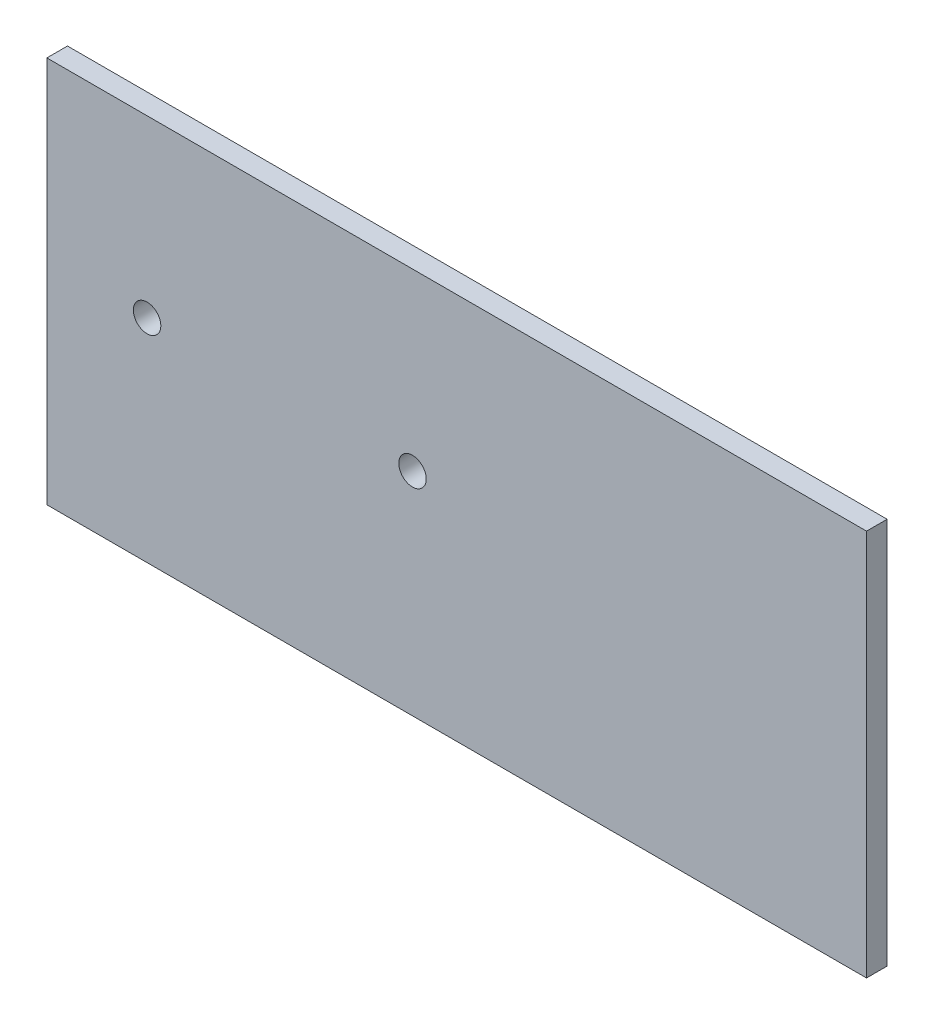
from build123d import *

# Parameters (mm, degrees)
SKETCH1_W           = 119.327486244
SKETCH1_H           = 56.342256392
SKETCH1_R           = 2
BOSS_EXTRUDE1_DEPTH = 3


with BuildPart() as part:
    # Sketch1 → Boss-Extrude1 (new body)
    with BuildSketch(Plane.XY):
        with Locations((-22.687120389, -2.682216881)):
            Rectangle(SKETCH1_W, SKETCH1_H)
        with Locations((-67.761571669, 0)):
            Circle(SKETCH1_R, mode=Mode.SUBTRACT)
        with Locations((-29.123771669, 0)):
            Circle(SKETCH1_R, mode=Mode.SUBTRACT)
    extrude(amount=BOSS_EXTRUDE1_DEPTH)


solid = part.part
